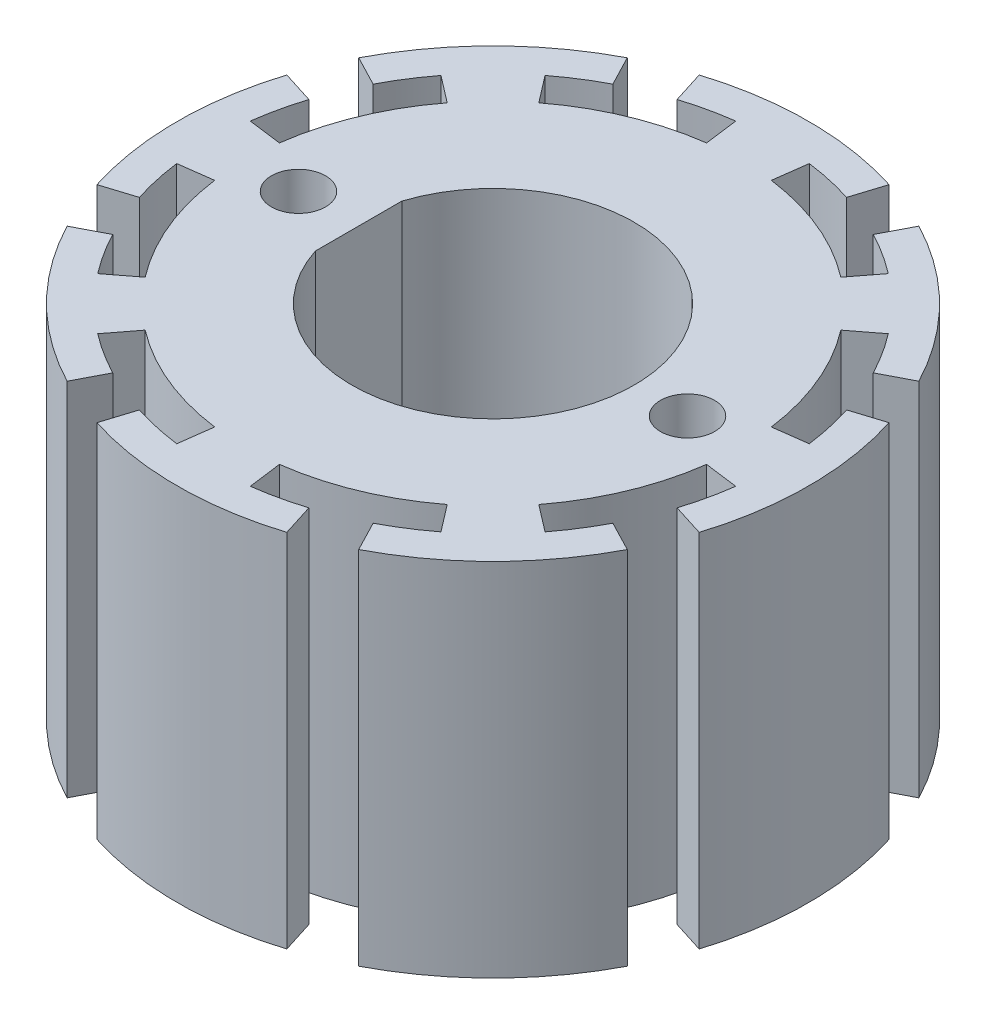
from build123d import *

# Parameters (mm, degrees)
SKETCH1_W           = 5.08
SKETCH1_H           = 0.3048
CUT_EXTRUDE1_DEPTH  = 33.328922036
CIRPATTERN1_COUNT   = 8
BOSS_EXTRUDE1_START = -20.32
BOSS_EXTRUDE1_DEPTH = 20.32
SKETCH8_R           = 1.524
CUT_EXTRUDE2_DEPTH  = 33.328922036


with BuildPart() as part:
    # Sketch1 → Revolve1 (revolve)
    with BuildSketch(Plane.YZ):
        with Locations((-2.54, 14.4526)):
            Rectangle(SKETCH1_W, SKETCH1_H)
        Polygon((0, 14.3002), (0, 7.9502), (-20.32, 7.9502), (-20.32, 17.78), (0, 17.78), (0, 14.605), (-5.08, 14.605), (-5.08, 14.3002), align=None)
    revolve(axis=Axis((0, 0, 0), (0, -1, 0)))

    # Sketch2 → Cut-Extrude1 (cut, through all)
    with BuildSketch(Plane(origin=(0, 0, 0), x_dir=(-1, 0, 0), z_dir=(0, 1, 0))):
        with BuildLine():
            ThreePointArc((15.771052614, 8.209890343), (16.426578088, 6.804111427), (16.957087384, 5.346549115))
            Line((16.957087384, 5.346549115), (15.140256593, 4.773704567))
            ThreePointArc((15.140256593, 4.773704567), (15.498699113, 3.435978871), (15.739187174, 2.072103301))
            Line((15.739187174, 2.072103301), (13.850484713, 1.823450905))
            ThreePointArc((13.850484713, 1.823450905), (12.906597069, 5.34608755), (11.083146164, 8.504397163))
            Line((11.083146164, 8.504397163), (12.594484277, 9.664087686))
            ThreePointArc((12.594484277, 9.664087686), (13.388839202, 8.529631283), (14.081296977, 7.330259235))
            Line((14.081296977, 7.330259235), (15.771052614, 8.209890343))
        make_face()
    cut_extrude1 = extrude(amount=-CUT_EXTRUDE1_DEPTH, mode=Mode.SUBTRACT)

    # CirPattern1: Cut-Extrude1 ×8 about axis
    cirpattern1_axis = Axis((0, 0, 0), (0, 1, 0))
    for i in range(1, CIRPATTERN1_COUNT):
        add(cut_extrude1.rotate(cirpattern1_axis, i * 360 / CIRPATTERN1_COUNT), mode=Mode.SUBTRACT)

    # Sketch5 → Boss-Extrude1 (add)
    with BuildSketch(Plane(origin=(0, 0, 0), x_dir=(1, 0, 0), z_dir=(0, 1, 0)).offset(BOSS_EXTRUDE1_START)):
        with BuildLine():
            Line((-7.5692, -2.431643765), (-7.5692, 2.431643765))
            ThreePointArc((-7.5692, 2.431643765), (-7.9502, 0), (-7.5692, -2.431643765))
        make_face()
    extrude(amount=BOSS_EXTRUDE1_DEPTH)

    # Sketch8 → Cut-Extrude2 (cut, through all)
    with BuildSketch(Plane(origin=(0, 0, 0), x_dir=(-1, 0, 0), z_dir=(0, 1, 0))):
        with Locations(Location((-10.95375, 0, 0), (0, 0, 90))):
            Circle(SKETCH8_R)
        with Locations(Location((10.95375, 0, 0), (0, 0, 90))):
            Circle(SKETCH8_R)
    extrude(amount=-CUT_EXTRUDE2_DEPTH, mode=Mode.SUBTRACT)


solid = part.part
